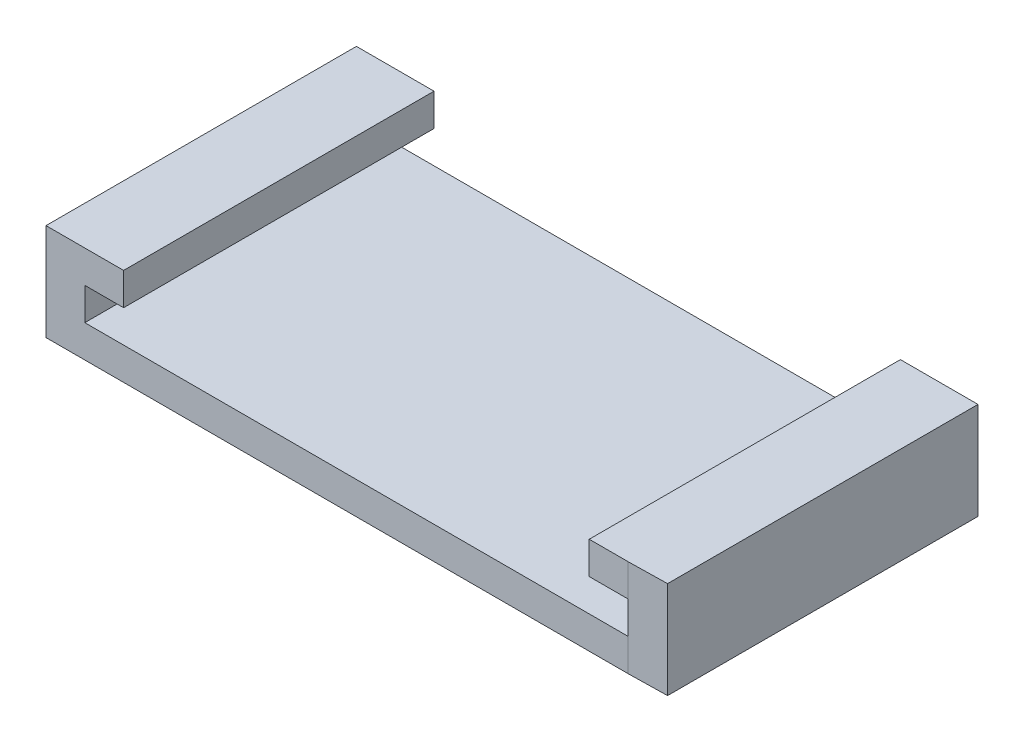
from build123d import *

# Parameters (mm, degrees)
ESQUISSE1_W        = 42
ESQUISSE1_H        = 24
BOSS_EXTRU_2_DEPTH = 2.5
ESQUISSE3_W        = 3
ESQUISSE3_H        = 24
BOSS_EXTRU_5_DEPTH = 7.5
BOSS_EXTRU_6_DEPTH = 3
ESQUISSE7_W        = 24
ESQUISSE7_H        = 2.5
BOSS_EXTRU_7_DEPTH = 3


with BuildPart() as part:
    # Esquisse1 → Boss.-Extru.2 (new body)
    with BuildSketch(Plane(origin=(0, 0, 0), x_dir=(1, 0, 0), z_dir=(0, 1, 0))):
        with Locations((21, 12)):
            Rectangle(ESQUISSE1_W, ESQUISSE1_H)
    extrude(amount=BOSS_EXTRU_2_DEPTH)

    # Esquisse3 → Boss.-Extru.5 (add)
    with BuildSketch(Plane.XZ):
        Polygon((42, 0), (44.999473272, -0.056214692), (45, -24.056214686), (42, -24.056214686), align=None)
        with Locations((-1.5, -12)):
            Rectangle(ESQUISSE3_W, ESQUISSE3_H)
    extrude(amount=-BOSS_EXTRU_5_DEPTH)

    # Esquisse6 → Boss.-Extru.6 (add)
    with BuildSketch(Plane.ZY.offset(-42)):
        Polygon((-24.056214686, 4.962472786), (0, 5), (0, 7.5), (-24.056214686, 7.5), align=None)
    extrude(amount=BOSS_EXTRU_6_DEPTH)

    # Esquisse7 → Boss.-Extru.7 (add)
    with BuildSketch(Plane(origin=(0, 0, 0), x_dir=(0, 0, -1), z_dir=(1, 0, 0))):
        with Locations((12, 6.25)):
            Rectangle(ESQUISSE7_W, ESQUISSE7_H)
    extrude(amount=BOSS_EXTRU_7_DEPTH)


solid = part.part
